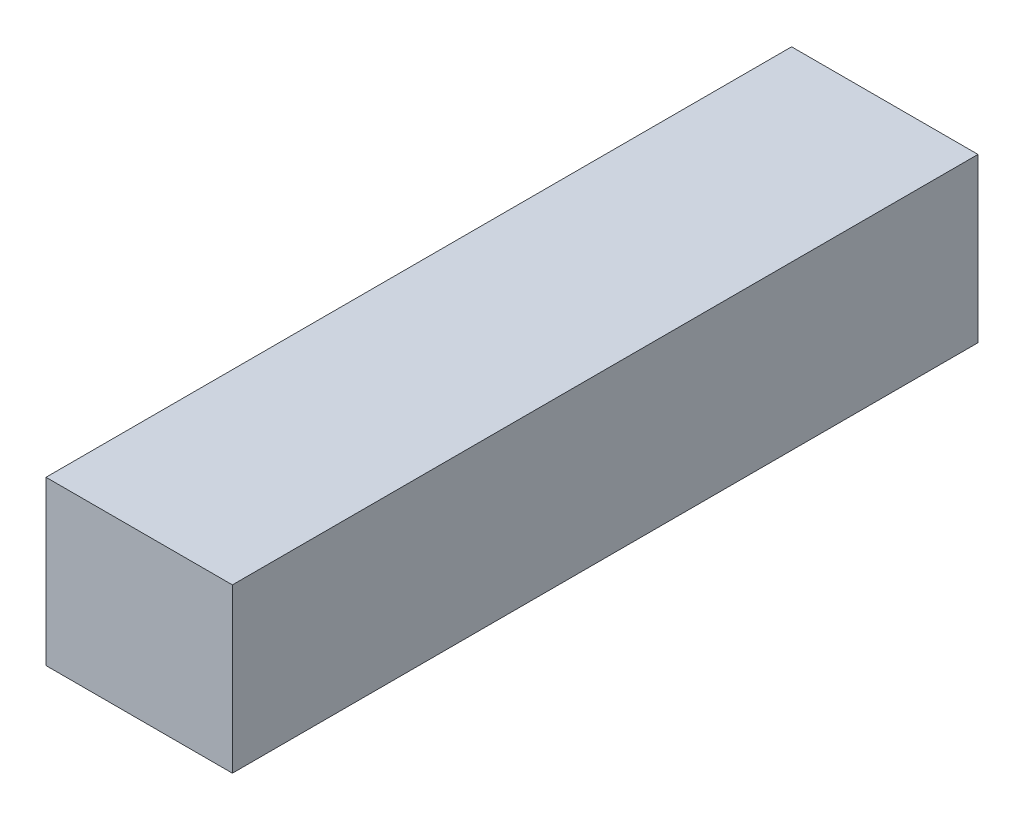
from build123d import *

# Parameters (mm, degrees)
SKETCH1_W           = 8
SKETCH1_H           = 7
BOSS_EXTRUDE1_DEPTH = 32


with BuildPart() as part:
    # Sketch1 → Boss-Extrude1 (new body)
    with BuildSketch(Plane.XY):
        Rectangle(SKETCH1_W, SKETCH1_H)
    extrude(amount=BOSS_EXTRUDE1_DEPTH)


solid = part.part
